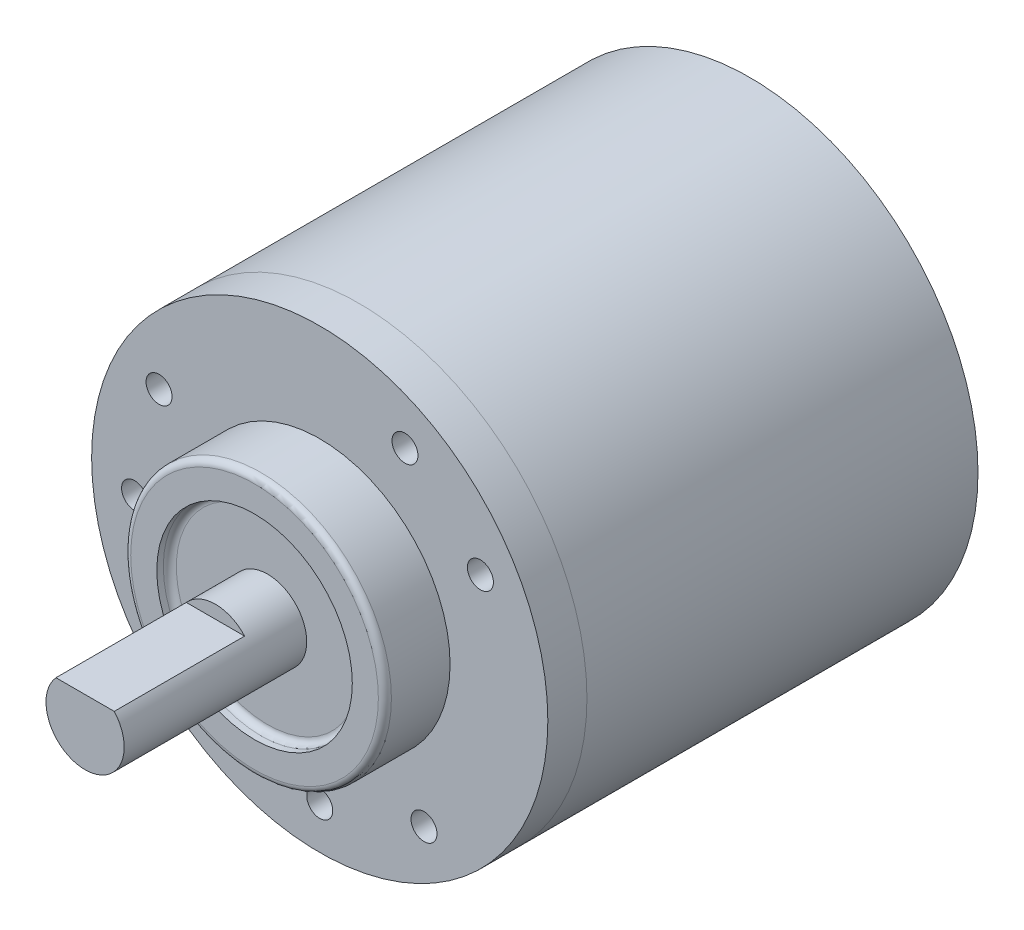
from build123d import *

# Parameters (mm, degrees)
SKETCH_1_R                    = 17.5
EXTRUDE_2_DEPTH               = 30
SKETCH_4_R                    = 17.5
EXTRUDE_4_DEPTH               = 3
SKETCH_5_R                    = 10
EXTRUDE_5_DEPTH               = 5
SKETCH_6_R                    = 7.5
CUT_EXTRUDE_1_DEPTH           = 1
FILLET_1_R                    = 0.5
SKETCH_7_R                    = 3
EXTRUDE_6_DEPTH               = 4
EXTRUDE_7_DEPTH               = 10
FILLET_2_R                    = 0.5
HOLE_WIZARD_3_48_1_AT_2_COUNT = 2
HOLE_WIZARD_3_48_1_AT_2_PITCH = 8.369999526
HOLE_WIZARD_3_48_1_AT_3_COUNT = 2
HOLE_WIZARD_3_48_1_AT_3_PITCH = 24.652251018
HOLE_WIZARD_3_48_1_AT_4_COUNT = 2
HOLE_WIZARD_3_48_1_AT_4_PITCH = 27.658687205
HOLE_WIZARD_3_48_1_AT_5_COUNT = 2
HOLE_WIZARD_3_48_1_AT_5_PITCH = 24.652251018
HOLE_WIZARD_3_48_1_AT_6_COUNT = 2
HOLE_WIZARD_3_48_1_AT_6_PITCH = 19.493735919


with BuildPart() as part:
    # 草图1 → 凸台-拉伸2 (new body)
    with BuildSketch(Plane.XY):
        Circle(SKETCH_1_R)
    extrude(amount=EXTRUDE_2_DEPTH)


with BuildPart() as body_2:
    # 草图4 → 凸台-拉伸4 (new body)
    with BuildSketch(Plane.XY.offset(30)):
        Circle(SKETCH_4_R)
    extrude(amount=EXTRUDE_4_DEPTH)

    # 草图5 → 凸台-拉伸5 (add)
    with BuildSketch(Plane.XY.offset(33)):
        Circle(SKETCH_5_R)
    extrude(amount=EXTRUDE_5_DEPTH)

    # 草图6 → 切除-拉伸1 (cut)
    with BuildSketch(Plane.XY.offset(38)):
        Circle(SKETCH_6_R)
    extrude(amount=-CUT_EXTRUDE_1_DEPTH, mode=Mode.SUBTRACT)

    # 圆角1
    fillet_1_edges = [body_2.edges().sort_by_distance(p)[0] for p in [
        (-7.5, 0, 37),
    ]]
    fillet(fillet_1_edges, radius=FILLET_1_R)

    # 草图7 → 凸台-拉伸6 (add)
    with BuildSketch(Plane.XY.offset(37)):
        Circle(SKETCH_7_R)
    extrude(amount=EXTRUDE_6_DEPTH)

    # 草图8 → 凸台-拉伸7 (add)
    with BuildSketch(Plane.XY.offset(41)):
        with BuildLine():
            Line((-2.236067977, 2), (2.236067977, 2))
            ThreePointArc((2.236067977, 2), (0, -3), (-2.236067977, 2))
        make_face()
    extrude(amount=EXTRUDE_7_DEPTH)

    # 圆角2
    fillet_2_edges = [body_2.edges().sort_by_distance(p)[0] for p in [
        (-10, 0, 38),
    ]]
    fillet(fillet_2_edges, radius=FILLET_2_R)


with BuildPart() as hole_wizard_3_48_1_tool:
    # 草图21 → #3-48 螺纹孔1 (revolve)
    with BuildSketch(Plane(origin=(0, -14.232983761, 33), x_dir=(0, -1, 0), z_dir=(1, 0, 0))):
        Polygon((0, 0), (0, 13.239027994), (0.99695, 12.64), (0.99695, 0), align=None)
    hole_wizard_3_48_1 = revolve(axis=Axis((0, -14.232983761, 39.35), (0, 0, -1)))


with BuildPart() as part_1:
    add(part.part)

    # #3-48 螺纹孔1: cut by hole_wizard_3_48_1_tool
    add(hole_wizard_3_48_1_tool.part, mode=Mode.SUBTRACT)


with BuildPart() as body_2_1:
    add(body_2.part)

    # #3-48 螺纹孔1: cut by hole_wizard_3_48_1_tool
    add(hole_wizard_3_48_1_tool.part, mode=Mode.SUBTRACT)


with BuildPart() as hole_wizard_3_48_1_at_2_tool:
    # #3-48 螺纹孔1 at 2: #3-48 螺纹孔1 ×2
    with Locations(*[Vector(0.9557945583075804, 0.2940353079302168, 0) * (i * HOLE_WIZARD_3_48_1_AT_2_PITCH) for i in range(1, HOLE_WIZARD_3_48_1_AT_2_COUNT)]):
        add(hole_wizard_3_48_1)


with BuildPart() as part_2:
    add(part_1.part)

    # #3-48 螺纹孔1 at 2: cut by hole_wizard_3_48_1_at_2_tool
    add(hole_wizard_3_48_1_at_2_tool.part, mode=Mode.SUBTRACT)


with BuildPart() as body_2_2:
    add(body_2_1.part)

    # #3-48 螺纹孔1 at 2: cut by hole_wizard_3_48_1_at_2_tool
    add(hole_wizard_3_48_1_at_2_tool.part, mode=Mode.SUBTRACT)


with BuildPart() as hole_wizard_3_48_1_at_3_tool:
    # #3-48 螺纹孔1 at 3: #3-48 螺纹孔1 ×2
    with Locations(*[Vector(0.500000000000004, 0.8660254037844364, 0) * (i * HOLE_WIZARD_3_48_1_AT_3_PITCH) for i in range(1, HOLE_WIZARD_3_48_1_AT_3_COUNT)]):
        add(hole_wizard_3_48_1)


with BuildPart() as part_3:
    add(part_2.part)

    # #3-48 螺纹孔1 at 3: cut by hole_wizard_3_48_1_at_3_tool
    add(hole_wizard_3_48_1_at_3_tool.part, mode=Mode.SUBTRACT)


with BuildPart() as body_2_3:
    add(body_2_2.part)

    # #3-48 螺纹孔1 at 3: cut by hole_wizard_3_48_1_at_3_tool
    add(hole_wizard_3_48_1_at_3_tool.part, mode=Mode.SUBTRACT)


with BuildPart() as hole_wizard_3_48_1_at_4_tool:
    # #3-48 螺纹孔1 at 4: #3-48 螺纹孔1 ×2
    with Locations(*[Vector(0.23646293387508172, 0.9716405101184228, 0) * (i * HOLE_WIZARD_3_48_1_AT_4_PITCH) for i in range(1, HOLE_WIZARD_3_48_1_AT_4_COUNT)]):
        add(hole_wizard_3_48_1)


with BuildPart() as part_4:
    add(part_3.part)

    # #3-48 螺纹孔1 at 4: cut by hole_wizard_3_48_1_at_4_tool
    add(hole_wizard_3_48_1_at_4_tool.part, mode=Mode.SUBTRACT)


with BuildPart() as body_2_4:
    add(body_2_3.part)

    # #3-48 螺纹孔1 at 4: cut by hole_wizard_3_48_1_at_4_tool
    add(hole_wizard_3_48_1_at_4_tool.part, mode=Mode.SUBTRACT)


with BuildPart() as hole_wizard_3_48_1_at_5_tool:
    # #3-48 螺纹孔1 at 5: #3-48 螺纹孔1 ×2
    with Locations(*[Vector(-0.5000000000000041, 0.8660254037844364, 0) * (i * HOLE_WIZARD_3_48_1_AT_5_PITCH) for i in range(1, HOLE_WIZARD_3_48_1_AT_5_COUNT)]):
        add(hole_wizard_3_48_1)


with BuildPart() as part_5:
    add(part_4.part)

    # #3-48 螺纹孔1 at 5: cut by hole_wizard_3_48_1_at_5_tool
    add(hole_wizard_3_48_1_at_5_tool.part, mode=Mode.SUBTRACT)


with BuildPart() as body_2_5:
    add(body_2_4.part)

    # #3-48 螺纹孔1 at 5: cut by hole_wizard_3_48_1_at_5_tool
    add(hole_wizard_3_48_1_at_5_tool.part, mode=Mode.SUBTRACT)


with BuildPart() as hole_wizard_3_48_1_at_6_tool:
    # #3-48 螺纹孔1 at 6: #3-48 螺纹孔1 ×2
    with Locations(*[Vector(-0.7287230936851111, 0.6848084788683628, 0) * (i * HOLE_WIZARD_3_48_1_AT_6_PITCH) for i in range(1, HOLE_WIZARD_3_48_1_AT_6_COUNT)]):
        add(hole_wizard_3_48_1)


with BuildPart() as part_6:
    add(part_5.part)

    # #3-48 螺纹孔1 at 6: cut by hole_wizard_3_48_1_at_6_tool
    add(hole_wizard_3_48_1_at_6_tool.part, mode=Mode.SUBTRACT)


with BuildPart() as body_2_6:
    add(body_2_5.part)

    # #3-48 螺纹孔1 at 6: cut by hole_wizard_3_48_1_at_6_tool
    add(hole_wizard_3_48_1_at_6_tool.part, mode=Mode.SUBTRACT)


solid = Compound([part_6.part, body_2_6.part])
